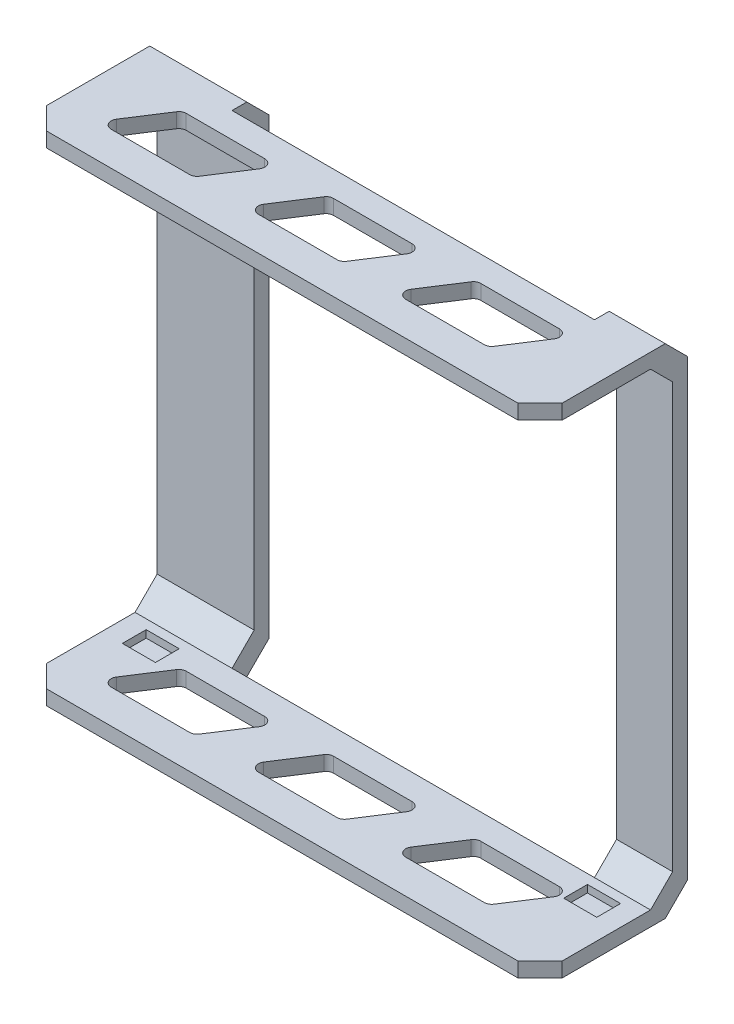
from build123d import *

# Parameters (mm, degrees)
SKETCH2_W               = 70
SKETCH2_H               = 67.6
BOSS_EXTRUDE2_DEPTH     = 20
SKETCH3_W               = 49.211808989
SKETCH3_H               = 73.758147992
CUT_EXTRUDE1_DEPTH      = 5
SHELL1_T                = -2
CHAMFER1_SIZE           = 3
CHAMFER2_SIZE           = 3
CUT_EXTRUDE2_REACH      = 80.917
FILLET1_R               = 1
FILLET1_OF_MIRROR1_R    = 1
SKETCH6_W               = 4.489342342
SKETCH6_H               = 3.232194467
CUT_EXTRUDE3_DEPTH      = 1
MIRROR3_COPY_1_SKETCH_W = 4.489342342
MIRROR3_COPY_1_SKETCH_H = 3.232194467
MIRROR3_COPY_1_DEPTH    = 1


with BuildPart() as part:
    # Sketch2 → Boss-Extrude2 (new body)
    with BuildSketch(Plane.XY):
        with Locations((0.470659816, 2.057998975)):
            Rectangle(SKETCH2_W, SKETCH2_H)
    extrude(amount=BOSS_EXTRUDE2_DEPTH)

    # Sketch3 → Cut-Extrude1 (cut)
    with BuildSketch(Plane(origin=(0, 0, 0), x_dir=(-1, 0, 0), z_dir=(0, 0, -1))):
        with Locations((-3.250634913, 2.948650711)):
            Rectangle(SKETCH3_W, SKETCH3_H)
    extrude(amount=-CUT_EXTRUDE1_DEPTH, mode=Mode.SUBTRACT)

    # Shell1
    shell1_openings = [part.faces().sort_by_distance(p)[0] for p in [
        (0.470659816, 2.057998975, 20),
        (3.250634912, 2.057998975, 5),
        (-21.355269582, 2.057998975, 2.5),
        (27.856539407, 2.057998975, 2.5),
        (35.470659816, 2.057998975, 10),
        (-34.529340184, 2.057998975, 10),
    ]]
    offset(amount=SHELL1_T, openings=shell1_openings, kind=Kind.INTERSECTION)

    # Chamfer1
    chamfer1_edges = [part.edges().sort_by_distance(p)[0] for p in [
        (-27.942304883, -29.742001025, 2),
        (31.663599611, -29.742001025, 2),
        (-27.942304883, 33.857998975, 2),
        (31.663599611, 33.857998975, 2),
        (-27.942304883, -31.742001025, 0),
        (31.663599611, -31.742001025, 0),
        (31.663599611, 35.857998975, 0),
        (-27.942304883, 35.857998975, 0),
    ]]
    chamfer(chamfer1_edges, length=CHAMFER1_SIZE)

    # Chamfer2
    chamfer2_edges = [part.edges().sort_by_distance(p)[0] for p in [
        (35.470659816, -30.742001025, 20),
        (-34.529340184, -30.742001025, 20),
        (35.470659816, 34.857998975, 20),
        (-34.529340184, 34.857998975, 20),
    ]]
    chamfer(chamfer2_edges, length=CHAMFER2_SIZE)

    # Sketch5 → Cut-Extrude2 (cut, up to next)
    with BuildSketch(Plane(origin=(0, 35.857998975, 0), x_dir=(1, 0, 0), z_dir=(0, 1, 0)), mode=Mode.PRIVATE) as cut_extrude2_sk1:
        Polygon((-29.190337507, -15.412371153), (-16.14250414, -15.412371153), (-11.632506267, -8.443693022), (-24.680339633, -8.443693022), align=None)
    cut_extrude2_tool1 = extrude(cut_extrude2_sk1.sketch, amount=-CUT_EXTRUDE2_REACH, mode=Mode.PRIVATE) & part.part
    # Sketch5 → Cut-Extrude2 (cut, up to next)
    with BuildSketch(Plane(origin=(0, 35.857998975, 0), x_dir=(1, 0, 0), z_dir=(0, 1, 0)), mode=Mode.PRIVATE) as cut_extrude2_sk2:
        Polygon((-9.190337507, -15.412371153), (3.85749586, -15.412371153), (8.367493733, -8.443693022), (-4.680339633, -8.443693022), align=None)
    cut_extrude2_tool2 = extrude(cut_extrude2_sk2.sketch, amount=-CUT_EXTRUDE2_REACH, mode=Mode.PRIVATE) & part.part
    # Sketch5 → Cut-Extrude2 (cut, up to next)
    with BuildSketch(Plane(origin=(0, 35.857998975, 0), x_dir=(1, 0, 0), z_dir=(0, 1, 0)), mode=Mode.PRIVATE) as cut_extrude2_sk3:
        Polygon((10.809662493, -15.412371153), (23.85749586, -15.412371153), (28.367493733, -8.443693022), (15.319660367, -8.443693022), align=None)
    cut_extrude2_tool3 = extrude(cut_extrude2_sk3.sketch, amount=-CUT_EXTRUDE2_REACH, mode=Mode.PRIVATE) & part.part
    cut_extrude2_1 = cut_extrude2_tool1.solids().sort_by_distance((-20.411422, 35.857999, 11.928032))[0]
    add(cut_extrude2_1, mode=Mode.SUBTRACT)
    cut_extrude2_2 = cut_extrude2_tool2.solids().sort_by_distance((-0.411422, 35.857999, 11.928032))[0]
    add(cut_extrude2_2, mode=Mode.SUBTRACT)
    cut_extrude2_3 = cut_extrude2_tool3.solids().sort_by_distance((19.588578, 35.857999, 11.928032))[0]
    add(cut_extrude2_3, mode=Mode.SUBTRACT)
    cut_extrude2 = cut_extrude2_1 + cut_extrude2_2 + cut_extrude2_3  # Cut-Extrude2 as one shape, for the pattern or mirror that repeats it

    # Fillet1
    fillet1_edges = [part.edges().sort_by_distance(p)[0] for p in [
        (-16.14250414, 34.857998975, 15.412371153),
        (-11.632506267, 34.857998975, 8.443693022),
        (-24.680339633, 34.857998975, 8.443693022),
        (-29.190337507, 34.857998975, 15.412371153),
        (3.85749586, 34.857998975, 15.412371153),
        (8.367493733, 34.857998975, 8.443693022),
        (-4.680339633, 34.857998975, 8.443693022),
        (-9.190337507, 34.857998975, 15.412371153),
        (23.85749586, 34.857998975, 15.412371153),
        (28.367493733, 34.857998975, 8.443693022),
        (15.319660367, 34.857998975, 8.443693022),
        (10.809662493, 34.857998975, 15.412371153),
    ]]
    fillet(fillet1_edges, radius=FILLET1_R)

    # Mirror1: Cut-Extrude2 across plane
    add(cut_extrude2.mirror(Plane.ZX.offset(2.057998975)), mode=Mode.SUBTRACT)

    # Fillet1 of Mirror1
    fillet1_of_mirror1_edges = [part.edges().sort_by_distance(p)[0] for p in [
        (-16.14250414, -30.742001025, 15.412371153),
        (-11.632506267, -30.742001025, 8.443693022),
        (-24.680339633, -30.742001025, 8.443693022),
        (-29.190337507, -30.742001025, 15.412371153),
        (3.85749586, -30.742001025, 15.412371153),
        (8.367493733, -30.742001025, 8.443693022),
        (-4.680339633, -30.742001025, 8.443693022),
        (-9.190337507, -30.742001025, 15.412371153),
        (23.85749586, -30.742001025, 15.412371153),
        (28.367493733, -30.742001025, 8.443693022),
        (15.319660367, -30.742001025, 8.443693022),
        (10.809662493, -30.742001025, 15.412371153),
    ]]
    fillet(fillet1_of_mirror1_edges, radius=FILLET1_OF_MIRROR1_R)

    # Sketch6 → Cut-Extrude3 (cut)
    with BuildSketch(Plane(origin=(0, -29.742001025, 0), x_dir=(1, 0, 0), z_dir=(0, 1, 0))):
        with Locations((-29.492893563, -7.894775984)):
            Rectangle(SKETCH6_W, SKETCH6_H)
    cut_extrude3 = extrude(amount=-CUT_EXTRUDE3_DEPTH, mode=Mode.SUBTRACT)

    # Mirror2: Cut-Extrude3 across plane
    add(cut_extrude3.mirror(Plane.ZX.offset(2.057998975)), mode=Mode.SUBTRACT)

    # Mirror3: Cut-Extrude3 across plane
    add(cut_extrude3.mirror(Plane(origin=(0.470659816, 0, 0), x_dir=(0, 0, 1), z_dir=(1, 0, 0))), mode=Mode.SUBTRACT)

    # Mirror3 copy 1 sketch → Mirror3 copy 1 (cut)
    with BuildSketch(Plane(origin=(0.941319632, 33.857998975, 0), x_dir=(-1, 0, 0), z_dir=(0, -1, 0))):
        with Locations((-29.492893563, -7.894775984)):
            Rectangle(MIRROR3_COPY_1_SKETCH_W, MIRROR3_COPY_1_SKETCH_H)
    extrude(amount=-MIRROR3_COPY_1_DEPTH, mode=Mode.SUBTRACT)


solid = part.part
